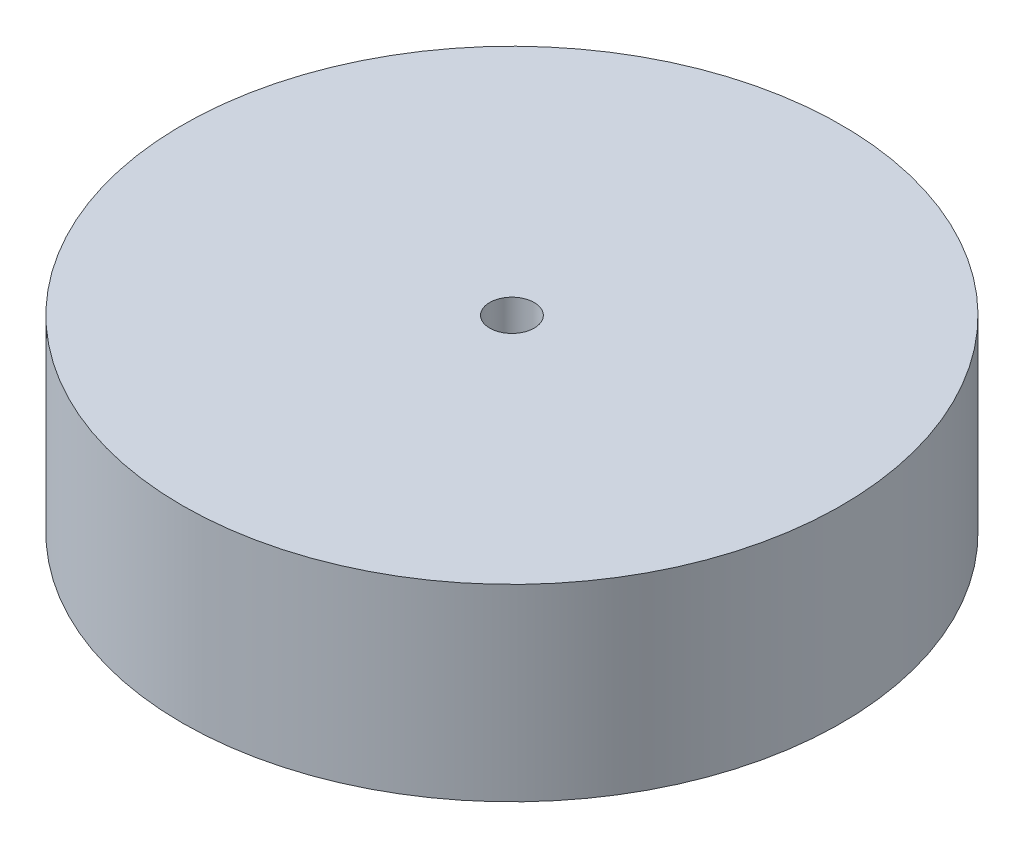
from build123d import *

# Parameters (mm, degrees)
SKETCH1_R           = 22.225
SKETCH1_R_2         = 1.5
BOSS_EXTRUDE1_DEPTH = 12.7


with BuildPart() as part:
    # Sketch1 → Boss-Extrude1 (new body)
    with BuildSketch(Plane(origin=(0, 0, 0), x_dir=(1, 0, 0), z_dir=(0, 1, 0))):
        with Locations(Location((0, 0, 0), (0, 0, 270))):
            Circle(SKETCH1_R)
        with Locations(Location((0, 0, 0), (0, 0, 270))):
            Circle(SKETCH1_R_2, mode=Mode.SUBTRACT)
    extrude(amount=BOSS_EXTRUDE1_DEPTH)


solid = part.part
